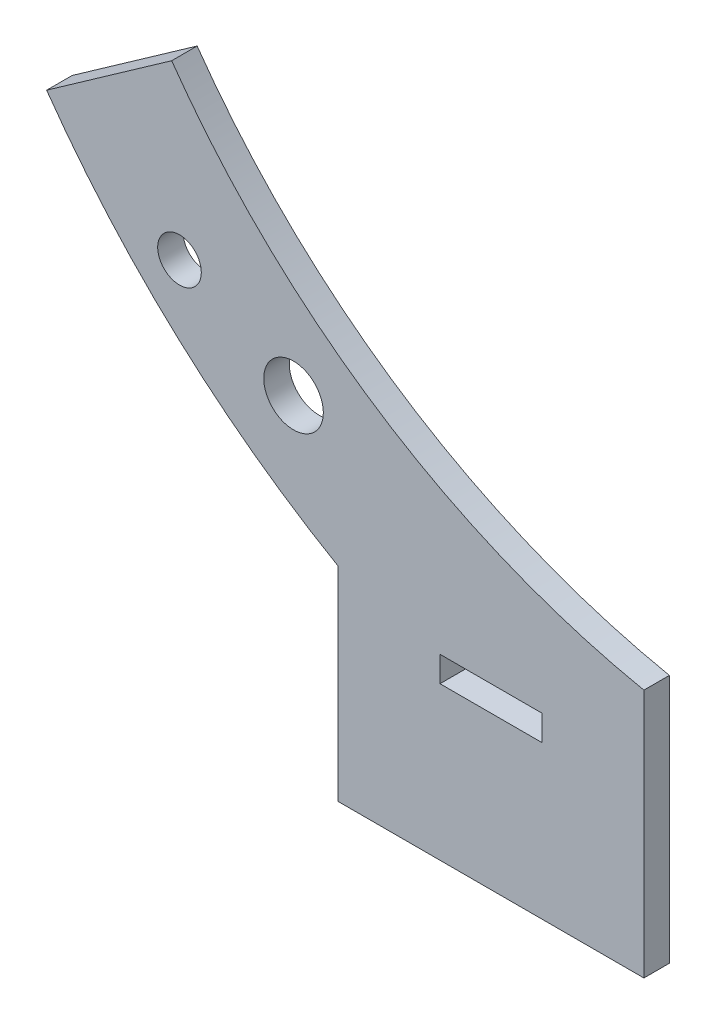
from build123d import *

# Parameters (mm, degrees)
SKETCH1_R           = 2.71553392
SKETCH1_R_2         = 3.710832544
SKETCH1_W           = 12.7
SKETCH1_H           = 3.175
BOSS_EXTRUDE1_DEPTH = 3.175


with BuildPart() as part:
    # Sketch1 → Boss-Extrude1 (new body)
    with BuildSketch(Plane.XY):
        with BuildLine():
            Line((-19.05, -124.386703653), (-19.05, -93.3255592))
            ThreePointArc((-19.05, -93.3255592), (-52.146864666, -79.707383632), (-77.881676461, -54.836183051))
            Line((-77.881676461, -54.836183051), (-93.458011754, -65.803419661))
            ThreePointArc((-93.458011754, -65.803419661), (-77.110154229, -84.371287265), (-57.15, -98.986703653))
            Line((-57.15, -98.986703653), (-57.15, -124.386703653))
            Line((-57.15, -124.386703653), (-19.05, -124.386703653))
        make_face()
        with Locations((-76.904233533, -75.837226531)):
            Circle(SKETCH1_R, mode=Mode.SUBTRACT)
        with Locations((-62.697046078, -83.364915406)):
            Circle(SKETCH1_R_2, mode=Mode.SUBTRACT)
        with Locations((-38.1, -103.749203653)):
            Rectangle(SKETCH1_W, SKETCH1_H, mode=Mode.SUBTRACT)
    extrude(amount=BOSS_EXTRUDE1_DEPTH)


solid = part.part
